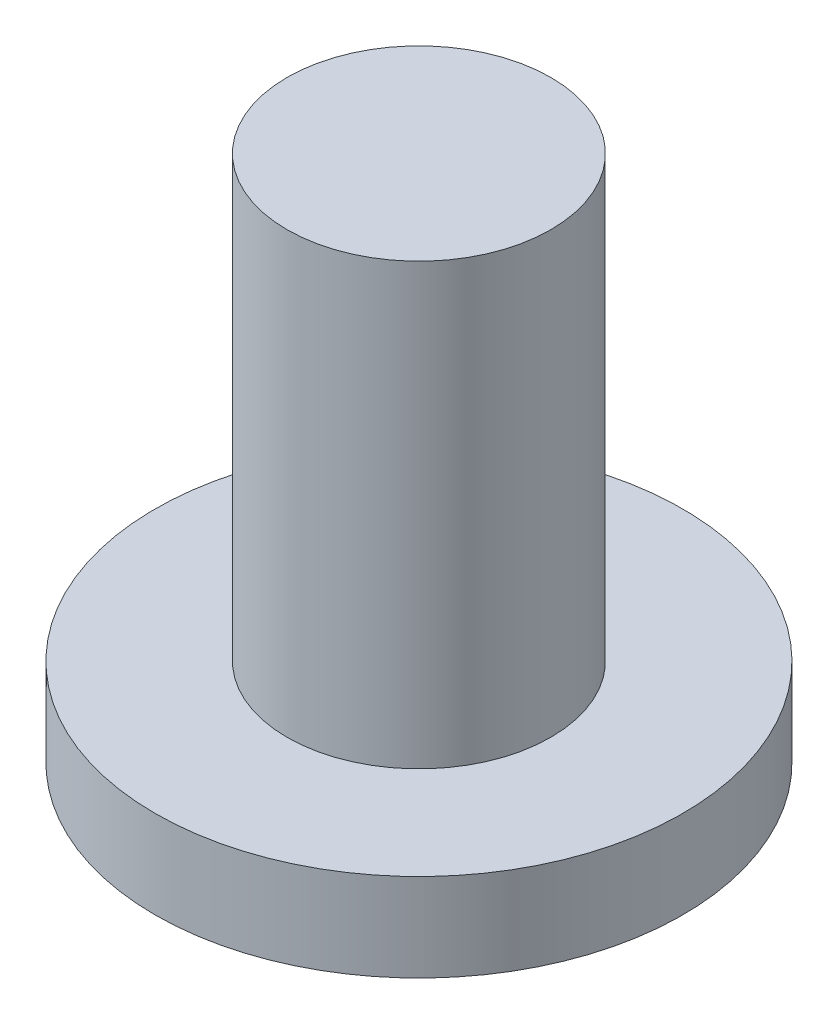
from build123d import *

# Parameters (mm, degrees)
SKETCH_1_R      = 6
EXTRUDE_1_DEPTH = 2
EXTRUDE_START   = 2
SKETCH_2_R      = 3
EXTRUDE_2_DEPTH = 10


with BuildPart() as part:
    # 草图1 → 凸台-拉伸1 (new body)
    with BuildSketch(Plane(origin=(0, 0, 0), x_dir=(1, 0, 0), z_dir=(0, 1, 0))):
        with Locations(Location((0, 0, 0), (0, 0, 270))):
            Circle(SKETCH_1_R)
    extrude(amount=EXTRUDE_1_DEPTH)

    # 草图2 → 凸台-拉伸2 (add)
    with BuildSketch(Plane(origin=(0, 0, 0), x_dir=(1, 0, 0), z_dir=(0, 1, 0)).offset(EXTRUDE_START)):
        with Locations(Location((0, 0, 0), (0, 0, 270))):
            Circle(SKETCH_2_R)
    extrude(amount=EXTRUDE_2_DEPTH)


solid = part.part
